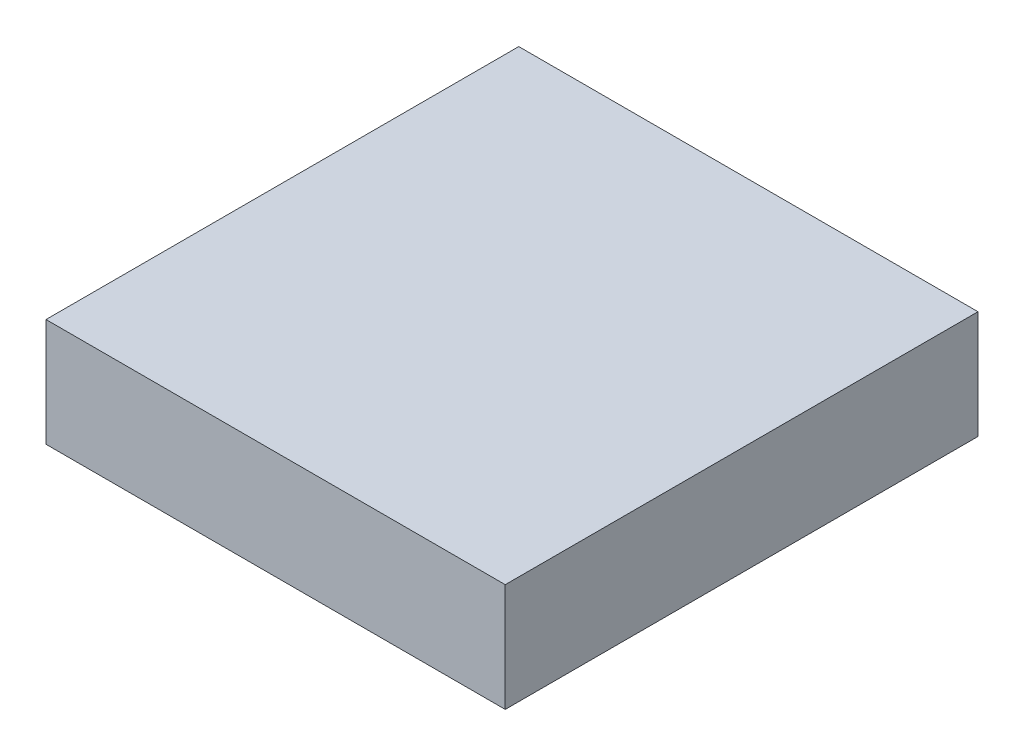
from build123d import *

# Parameters (mm, degrees)
SKETCH2_W           = 86.36
SKETCH2_H           = 88.9
BOSS_EXTRUDE1_DEPTH = 20.32


with BuildPart() as part:
    # Sketch2 → Boss-Extrude1 (new body)
    with BuildSketch(Plane(origin=(0, 0, 0), x_dir=(1, 0, 0), z_dir=(0, 1, 0))):
        Rectangle(SKETCH2_W, SKETCH2_H)
    extrude(amount=BOSS_EXTRUDE1_DEPTH)


solid = part.part
